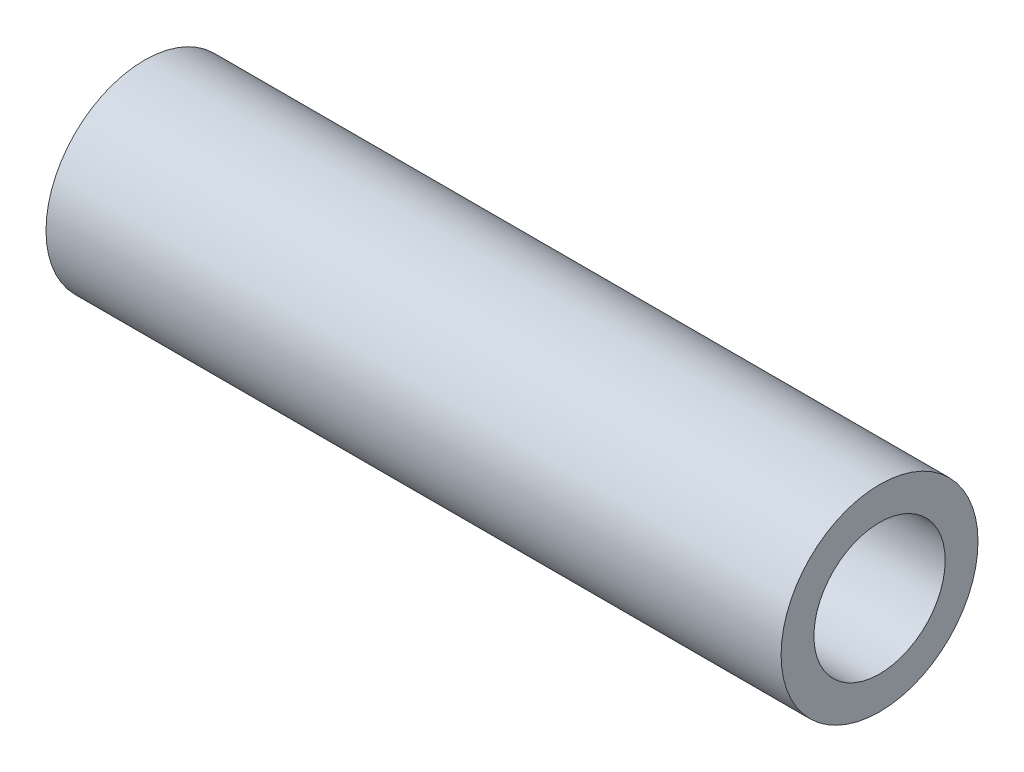
from build123d import *

# Parameters (mm, degrees)
SKETCH1_R           = 2.38125
SKETCH1_R_2         = 1.5875
BOSS_EXTRUDE1_DEPTH = 17.78


with BuildPart() as part:
    # Sketch1 → Boss-Extrude1 (new body)
    with BuildSketch(Plane(origin=(0, 0, 0), x_dir=(0, 0, -1), z_dir=(1, 0, 0))):
        Circle(SKETCH1_R)
        Circle(SKETCH1_R_2, mode=Mode.SUBTRACT)
    extrude(amount=BOSS_EXTRUDE1_DEPTH)


solid = part.part
